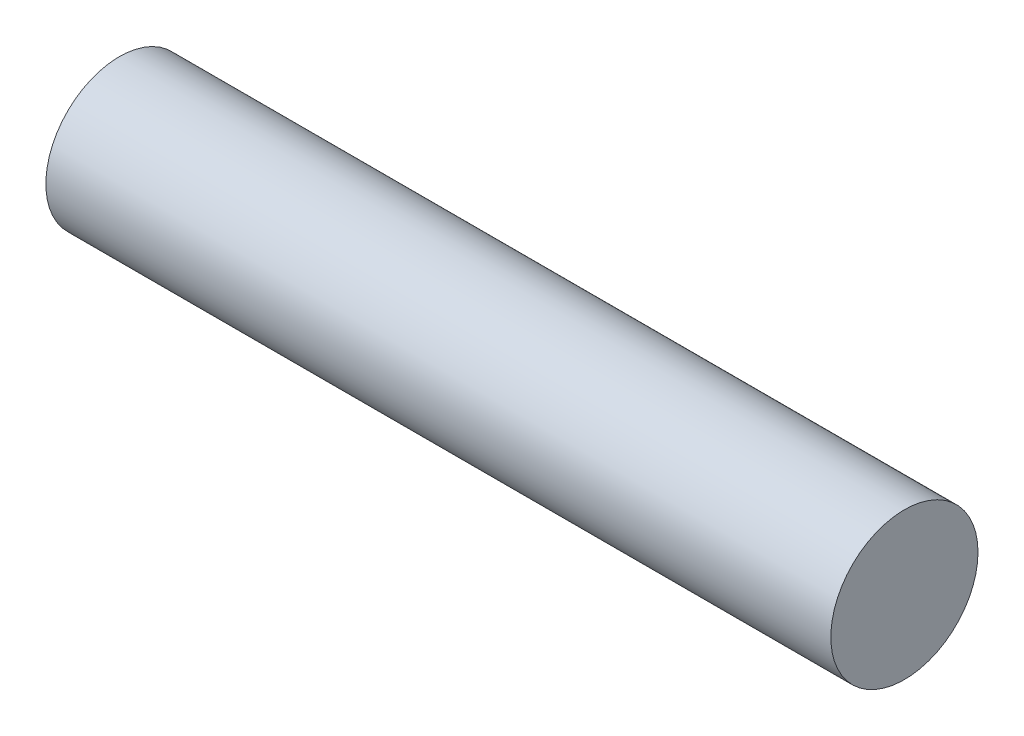
from build123d import *

# Parameters (mm, degrees)
ESQUISSE1_R        = 15
BOSS_EXTRU_1_DEPTH = 160


with BuildPart() as part:
    # Esquisse1 → Boss.-Extru.1 (new body)
    with BuildSketch(Plane(origin=(0, 0, 0), x_dir=(0, 0, -1), z_dir=(1, 0, 0))):
        Circle(ESQUISSE1_R)
    extrude(amount=BOSS_EXTRU_1_DEPTH)


solid = part.part
